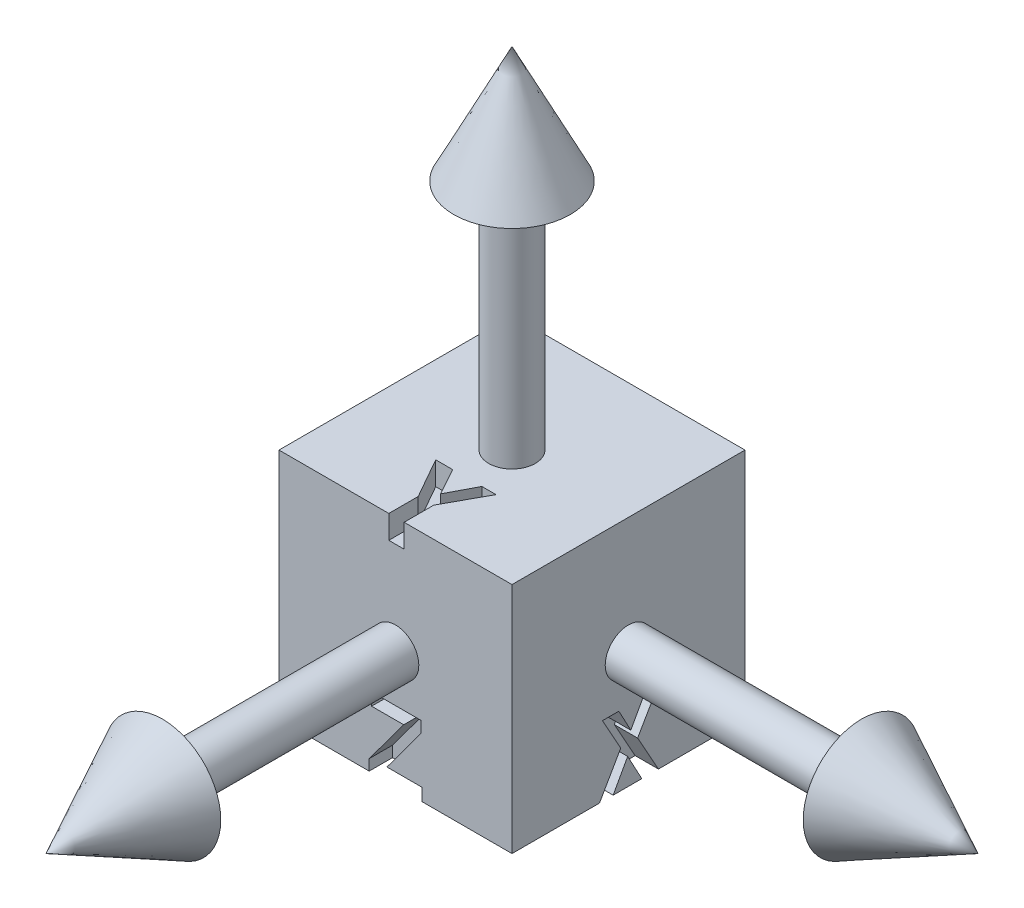
from build123d import *

# Parameters (mm, degrees)
BODY_MOVE_COPY1_ANGLE    = 90
BODY_MOVE_COPY2_ANGLE    = 90
BOSS_EXTRUDE2_DEPTH      = 25
BOSS_EXTRUDE2_DEPTH_BACK = 25
SKETCH6_W                = 50
SKETCH6_H                = 50
CUT_EXTRUDE1_DEPTH       = 5
CUT_EXTRUDE2_DEPTH       = 5
CUT_EXTRUDE3_DEPTH       = 5


with BuildPart() as part:
    # Sketch4 → Revolve1 (revolve)
    with BuildSketch(Plane.XY):
        Polygon((0, 100), (0, 0), (5, 0), (5, 75), (12.5, 75), align=None)
    revolve(axis=Axis((0, 100, 0), (0, -1, 0)))


with BuildPart() as body_2:
    # Sketch5 → Revolve2 (revolve)
    with BuildSketch(Plane.XY):
        with BuildLine():
            Line((0, 10), (0, -10))
            ThreePointArc((0, -10), (10, 0), (0, 10))
        make_face()
    revolve(axis=Axis((0, 10, 0), (0, -1, 0)))


with BuildPart() as body_3:
    # Body-Move/Copy1: copy of part
    add(part.part.rotate(Axis((0, 0, 0), (0, 0, -1)), BODY_MOVE_COPY1_ANGLE))


with BuildPart() as body_4:
    # Body-Move/Copy2: copy of part
    add(part.part.rotate(Axis((0, 0, 0), (1, 0, 0)), BODY_MOVE_COPY2_ANGLE))


with BuildPart() as body_5:
    # Sketch6 → Boss-Extrude2 (new, two sides: drawn at the far end of the back side and taken through both)
    with BuildSketch(Plane(origin=(0, 0, 0), x_dir=(1, 0, 0), z_dir=(0, 1, 0)).offset(-BOSS_EXTRUDE2_DEPTH_BACK)):
        Rectangle(SKETCH6_W, SKETCH6_H)
    extrude(amount=BOSS_EXTRUDE2_DEPTH + BOSS_EXTRUDE2_DEPTH_BACK)

    # Sketch7 → Cut-Extrude1 (cut)
    with BuildSketch(Plane(origin=(0, 25, 0), x_dir=(1, 0, 0), z_dir=(0, 1, 0))):
        Polygon((1.849315068, -25), (-1.438356164, -25), (-1.438356164, -18.691138699), (-6.369863014, -10), (-2.71297089, -10), (0.478381849, -15.811215753), (3.534888699, -10), (6.575342466, -10), (1.849315068, -18.630136986), align=None)
    extrude(amount=-CUT_EXTRUDE1_DEPTH, mode=Mode.SUBTRACT)

    # Sketch8 → Cut-Extrude2 (cut)
    with BuildSketch(Plane(origin=(25, 0, 0), x_dir=(0, 0, -1), z_dir=(1, 0, 0))):
        Polygon((6.421232877, -25), (2.854238014, -25), (-0.183005137, -19.346104452), (-3.294092466, -25), (-6.215753425, -25), (-1.669520548, -17.056934932), (-5.599315068, -10), (-2.06442637, -10), (0.494434932, -14.812714041), (3.152825342, -10), (6.010273973, -10), (1.958476027, -17.005565068), align=None)
    extrude(amount=-CUT_EXTRUDE2_DEPTH, mode=Mode.SUBTRACT)

    # Sketch9 → Cut-Extrude3 (cut)
    with BuildSketch(Plane.XY.offset(25)):
        Polygon((5.650684932, -22.328767123), (5.650684932, -25), (-5.650684932, -25), (-5.650684932, -22.675513699), (1.762628425, -12.671232877), (-5.130565068, -12.671232877), (-5.130565068, -10), (5.438784247, -10), (5.438784247, -12.472174658), (-1.836472603, -22.328767123), align=None)
    extrude(amount=-CUT_EXTRUDE3_DEPTH, mode=Mode.SUBTRACT)


solid = Compound([part.part, body_2.part, body_3.part, body_4.part, body_5.part])
